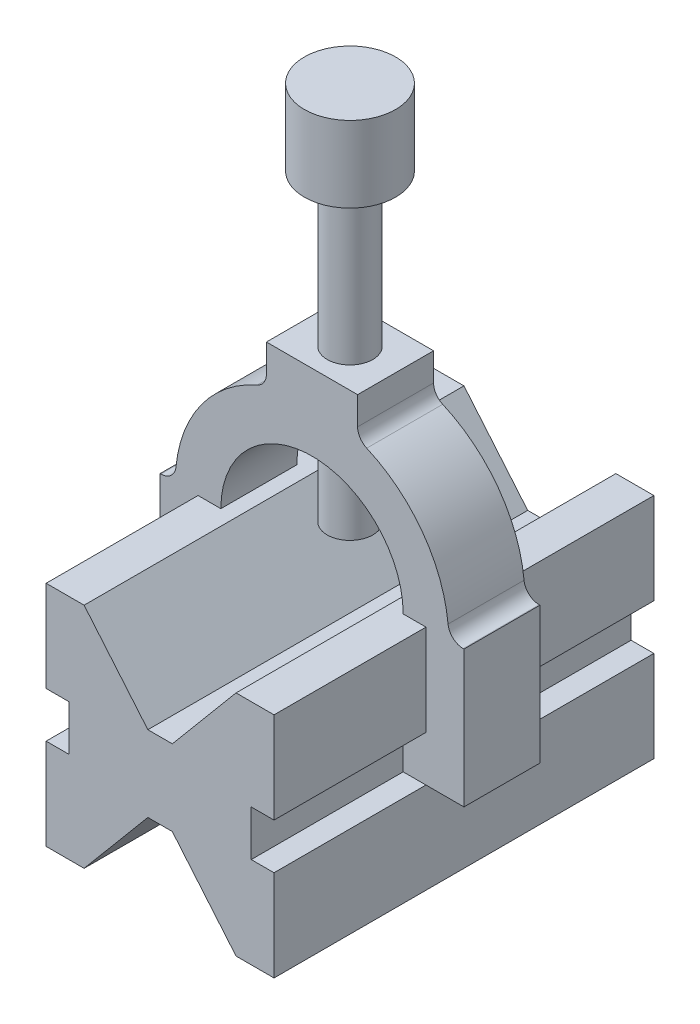
from build123d import *

# Parameters (mm, degrees)
BOSS_EXTRUDE1_DEPTH      = 50
BOSS_EXTRUDE2_DEPTH      = 10
BOSS_EXTRUDE4_START      = -20
SKETCH4_W                = 10
SKETCH4_H                = 24
BOSS_EXTRUDE4_DEPTH      = 20
BOSS_EXTRUDE5_DEPTH      = 20
CUT_EXTRUDE1_REACH       = 124.131
CUT_EXTRUDE1_END_RADIUS  = 24
SKETCH6_R                = 6
FILLET1_R                = 4
BOSS_EXTRUDE6_DEPTH      = 40
BOSS_EXTRUDE6_DEPTH_BACK = 40
SKETCH7_R                = 6
SKETCH8_R                = 12
SKETCH8_R_2              = 6
BOSS_EXTRUDE7_DEPTH      = 20


with BuildPart() as part:
    # Sketch1 → Boss-Extrude1 (new, symmetric)
    with BuildSketch(Plane.XY):
        Polygon((24, 0), (-24, 0), (-24, -6), (-30, -6), (-30, -30), (-20, -30), (-3.218007376, -10), (3.218007376, -10), (20, -30), (30, -30), (30, -6), (24, -6), align=None)
        Polygon((3.218007376, 10), (-3.218007376, 10), (-20, 30), (-30, 30), (-30, 6), (-24, 6), (-24, 0), (24, 0), (24, 6), (30, 6), (30, 30), (20, 30), align=None)
    extrude(amount=BOSS_EXTRUDE1_DEPTH, both=True)


with BuildPart() as body_2:
    # Sketch2 → Boss-Extrude2 (new, symmetric)
    with BuildSketch(Plane.XY):
        Polygon((24, -6), (30, -6), (40, -6), (40, 6), (30, 6), (24, 6), align=None)
    extrude(amount=BOSS_EXTRUDE2_DEPTH, both=True)

    # Sketch4 → Boss-Extrude4 (add)
    with BuildSketch(Plane.XY.offset(10).offset(BOSS_EXTRUDE4_START)):
        with Locations((35, 18)):
            Rectangle(SKETCH4_W, SKETCH4_H)
    extrude(amount=BOSS_EXTRUDE4_DEPTH)


with BuildPart() as body_3:
    # Mirror2: mirrored copy
    add(body_2.part.mirror(Plane(origin=(0, 0, 0), x_dir=(0, 0, 1), z_dir=(1, 0, 0))))


with BuildPart() as body_2_1:
    add(body_2.part)

    # Sketch5 → Boss-Extrude5 (add)
    with BuildSketch(Plane.XY.offset(10)):
        with BuildLine():
            ThreePointArc((-12, 63.941125497), (-29.393876913, 50.784609691), (-36, 30))
            Line((-36, 30), (-30, 30))
            Line((-30, 30), (-24, 30))
            ThreePointArc((-24, 30), (0, 54), (24, 30))
            Line((24, 30), (30, 30))
            Line((30, 30), (36, 30))
            ThreePointArc((36, 30), (29.393876913, 50.784609691), (12, 63.941125497))
            Line((12, 63.941125497), (12, 74))
            Line((12, 74), (-12, 74))
            Line((-12, 74), (-12, 63.941125497))
        make_face()
    extrude(amount=-BOSS_EXTRUDE5_DEPTH)

    # Combine2: union body 3
    add(body_3.part)

    # Cut-Extrude1: up to this cylinder (the profile starts outside it)
    cut_extrude1_end = Plane(origin=(0, 30, 0), z_dir=(0, 0, 1)) * Cylinder(CUT_EXTRUDE1_END_RADIUS, 297.262, mode=Mode.PRIVATE)
    # Sketch6 → Cut-Extrude1 (cut, up to the surface)
    with BuildSketch(Plane(origin=(0, 74, 0), x_dir=(1, 0, 0), z_dir=(0, 1, 0)), mode=Mode.PRIVATE) as cut_extrude1_sk1:
        with Locations(Location((0, 0, 0), (0, 0, 270))):
            Circle(SKETCH6_R)
    cut_extrude1_tool1 = extrude(cut_extrude1_sk1.sketch, amount=-CUT_EXTRUDE1_REACH, mode=Mode.PRIVATE) - cut_extrude1_end
    add(cut_extrude1_tool1.solids().sort_by_distance((0, 74, 0))[0], mode=Mode.SUBTRACT)

    # Fillet1
    fillet1_edges = [body_2_1.edges().sort_by_distance(p)[0] for p in [
        (36, 30, 0),
        (-12, 63.941125497, 0),
        (12, 63.941125497, 0),
        (-36, 30, 0),
    ]]
    fillet(fillet1_edges, radius=FILLET1_R)


with BuildPart() as body_3_2:
    # Sketch7 → Boss-Extrude6 (new, two sides: drawn at the far end of the back side and taken through both)
    with BuildSketch(Plane(origin=(0, 74, 0), x_dir=(1, 0, 0), z_dir=(0, 1, 0)).offset(-BOSS_EXTRUDE6_DEPTH_BACK)):
        with Locations(Location((0, 0, 0), (0, 0, 270))):
            Circle(SKETCH7_R)
    extrude(amount=BOSS_EXTRUDE6_DEPTH + BOSS_EXTRUDE6_DEPTH_BACK)

    # Sketch8 → Boss-Extrude7 (add)
    # profile 1 of 2: a face of its own
    with BuildSketch(Plane(origin=(0, 114, 0), x_dir=(1, 0, 0), z_dir=(0, 1, 0))):
        with Locations(Location((0, 0, 0), (0, 0, 270))):
            Circle(SKETCH8_R)
        with Locations(Location((0, 0, 0), (0, 0, 270))):
            Circle(SKETCH8_R_2, mode=Mode.SUBTRACT)
    # profile 2 of 2: a face of its own
    with BuildSketch(Plane(origin=(0, 114, 0), x_dir=(1, 0, 0), z_dir=(0, 1, 0))):
        with Locations(Location((0, 0, 0), (0, 0, 270))):
            Circle(SKETCH8_R_2)
    extrude(amount=BOSS_EXTRUDE7_DEPTH)


solid = Compound([part.part, body_2_1.part, body_3_2.part])
